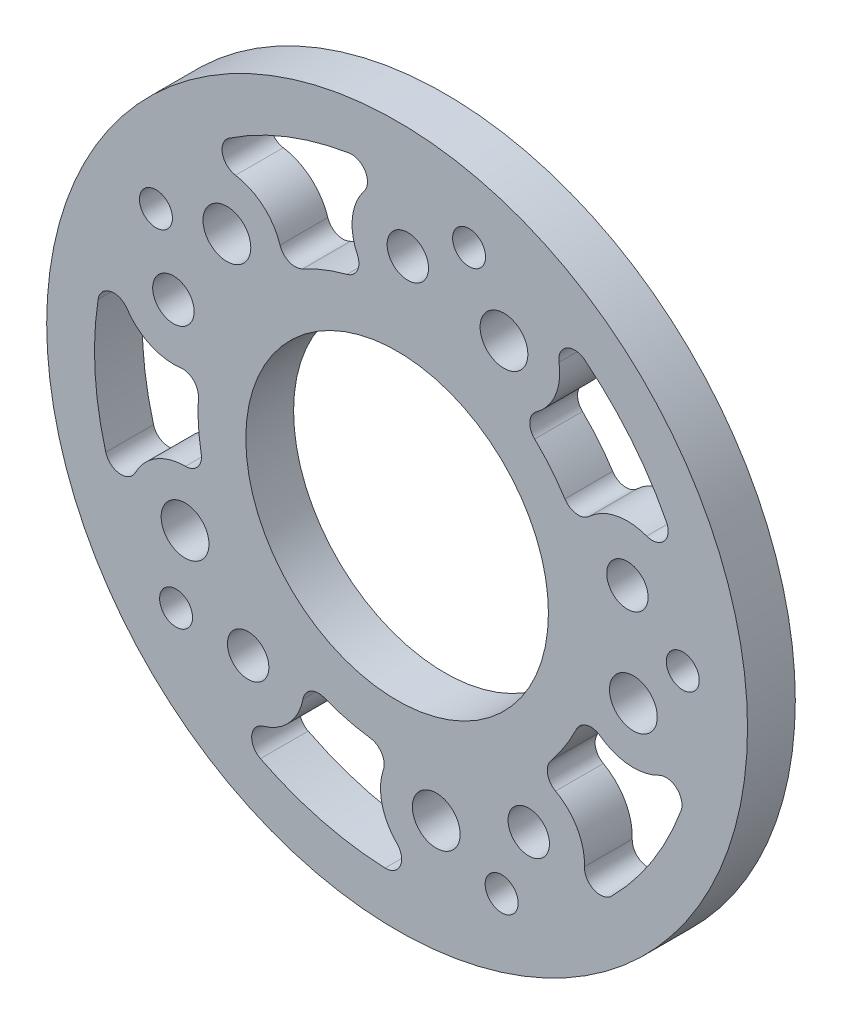
from build123d import *

# Parameters (mm, degrees)
SKETCH_1_R      = 22
SKETCH_1_R_2    = 9.5
SKETCH_1_R_3    = 1.3
SKETCH_1_R_4    = 1.5
SKETCH_1_R_5    = 1.035150144
EXTRUDE_1_DEPTH = 3


with BuildPart() as part:
    # 草图1 → 凸台-拉伸1 (new body)
    with BuildSketch(Plane.XY):
        Circle(SKETCH_1_R)
        Circle(SKETCH_1_R_2, mode=Mode.SUBTRACT)
        with Locations((8.264326198, -12.518023506)):
            Circle(SKETCH_1_R_3, mode=Mode.SUBTRACT)
        with Locations((-9.351530584, -11.728123283)):
            Circle(SKETCH_1_R_3, mode=Mode.SUBTRACT)
        with Locations((-14.043889946, 5.269644693)):
            Circle(SKETCH_1_R_3, mode=Mode.SUBTRACT)
        with Locations((0.671929263, 14.984942812)):
            Circle(SKETCH_1_R_3, mode=Mode.SUBTRACT)
        with Locations((14.459165069, 3.991559284)):
            Circle(SKETCH_1_R_3, mode=Mode.SUBTRACT)
        with Locations((6.708763262, 13.416128186)):
            Circle(SKETCH_1_R_4, mode=Mode.SUBTRACT)
        with Locations((14.832617994, -2.234601409)):
            Circle(SKETCH_1_R_4, mode=Mode.SUBTRACT)
        with Locations((2.4582988, -14.797187807)):
            Circle(SKETCH_1_R_4, mode=Mode.SUBTRACT)
        with Locations((-13.313305781, -6.910563594)):
            Circle(SKETCH_1_R_4, mode=Mode.SUBTRACT)
        with Locations((-10.686374275, 10.526224625)):
            Circle(SKETCH_1_R_4, mode=Mode.SUBTRACT)
        with Locations((-15.140028741, 9.670334022)):
            Circle(SKETCH_1_R_5, mode=Mode.SUBTRACT)
        with Locations((4.51850801, 17.387320545)):
            Circle(SKETCH_1_R_5, mode=Mode.SUBTRACT)
        with Locations((17.932620269, 1.075621048)):
            Circle(SKETCH_1_R_5, mode=Mode.SUBTRACT)
        with Locations((6.564460824, -16.722550178)):
            Circle(SKETCH_1_R_5, mode=Mode.SUBTRACT)
        with Locations((-13.875560362, -11.410725437)):
            Circle(SKETCH_1_R_5, mode=Mode.SUBTRACT)
        with BuildLine():
            ThreePointArc((-5.923480438, 11.007378412), (-6.772768209, 10.961109563), (-7.350473407, 11.585358894))
            ThreePointArc((-7.350473407, 11.585358894), (-8.407095271, 13.182328392), (-10.145967922, 13.984253106))
            ThreePointArc((-10.145967922, 13.984253106), (-10.968173498, 14.757231005), (-10.546653113, 15.804053534))
            ThreePointArc((-10.546653113, 15.804053534), (-6.942710719, 17.686117943), (-3.020854346, 18.758316529))
            ThreePointArc((-3.020854346, 18.758316529), (-1.999770978, 18.277790153), (-2.076575062, 17.151904734))
            ThreePointArc((-2.076575062, 17.151904734), (-2.805565056, 15.381217034), (-2.49364552, 13.491913579))
            ThreePointArc((-2.49364552, 13.491913579), (-2.492417598, 12.641367275), (-3.146384684, 12.097531295))
            ThreePointArc((-3.146384684, 12.097531295), (-4.567572841, 11.63560391), (-5.923480438, 11.007378412))
        make_face(mode=Mode.SUBTRACT)
        with BuildLine():
            ThreePointArc((10.533149631, 6.730732416), (9.654659288, 7.939619262), (8.638182844, 9.035031663))
            ThreePointArc((8.638182844, 9.035031663), (8.3317342, 9.82845447), (8.74690987, 10.570788416))
            ThreePointArc((8.74690987, 10.570788416), (9.939204005, 12.069186239), (10.164538529, 13.97076077))
            ThreePointArc((10.164538529, 13.97076077), (10.645608702, 14.991588048), (11.771453052, 14.91418429))
            ThreePointArc((11.771453052, 14.91418429), (14.675082118, 12.068221279), (16.90672384, 8.669641804))
            ThreePointArc((16.90672384, 8.669641804), (16.765248211, 7.550042997), (15.67073378, 7.275170293))
            ThreePointArc((15.67073378, 7.275170293), (13.761439408, 7.421308386), (12.060993483, 6.540828404))
            ThreePointArc((12.060993483, 6.540828404), (11.252455327, 6.276827318), (10.533149631, 6.730732416))
        make_face(mode=Mode.SUBTRACT)
        with BuildLine():
            ThreePointArc((9.656229164, -7.937709892), (10.534480431, -6.728649348), (11.262171037, -5.423421755))
            ThreePointArc((11.262171037, -5.423421755), (11.92206313, -4.886790644), (12.756361003, -5.052252365))
            ThreePointArc((12.756361003, -5.052252365), (14.549861167, -5.72316108), (16.427998213, -5.349848101))
            ThreePointArc((16.427998213, -5.349848101), (17.547521507, -5.491920046), (17.821811196, -6.586580728))
            ThreePointArc((17.821811196, -6.586580728), (16.012410255, -10.227547009), (13.469784317, -13.400183224))
            ThreePointArc((13.469784317, -13.400183224), (12.361264202, -13.611606964), (11.761621167, -12.655602219))
            ThreePointArc((11.761621167, -12.655602219), (11.310602344, -10.794596211), (9.947749431, -9.449459311))
            ThreePointArc((9.947749431, -9.449459311), (9.446817447, -8.762074651), (9.656229164, -7.937709892))
        make_face(mode=Mode.SUBTRACT)
        with BuildLine():
            ThreePointArc((-4.565271804, -11.636506922), (-3.143992328, -12.098153257), (-1.677778356, -12.386890642))
            ThreePointArc((-1.677778356, -12.386890642), (-0.96349397, -12.848657184), (-0.863045197, -13.693252097))
            ThreePointArc((-0.863045197, -13.693252097), (-0.946895272, -15.60629431), (-0.011477266, -17.277148731))
            ThreePointArc((-0.011477266, -17.277148731), (0.199356008, -18.3857813), (-0.756967992, -18.98491505))
            ThreePointArc((-0.756967992, -18.98491505), (-4.778868338, -18.389192951), (-8.58193931, -16.951410492))
            ThreePointArc((-8.58193931, -16.951410492), (-9.12556679, -15.962478742), (-8.401652136, -15.096762613))
            ThreePointArc((-8.401652136, -15.096762613), (-6.771102726, -14.092735739), (-5.912946223, -12.380915433))
            ThreePointArc((-5.912946223, -12.380915433), (-5.414001059, -11.692087264), (-4.565271804, -11.636506922))
        make_face(mode=Mode.SUBTRACT)
        with BuildLine():
            ThreePointArc((-12.477722307, 0.745953104), (-12.47757455, -0.748420566), (-12.299095087, -2.232097677))
            ThreePointArc((-12.299095087, -2.232097677), (-12.517535151, -3.054116206), (-13.289752269, -3.410642848))
            ThreePointArc((-13.289752269, -3.410642848), (-15.135074629, -3.922059242), (-16.435091554, -5.328017043))
            ThreePointArc((-16.435091554, -5.328017043), (-17.424312718, -5.871117707), (-18.289643143, -5.146742046))
            ThreePointArc((-18.289643143, -5.146742046), (-18.965913316, -1.137599261), (-18.773714501, 2.923635383))
            ThreePointArc((-18.773714501, 2.923635383), (-18.001174645, 3.746252557), (-16.954127749, 3.325289805))
            ThreePointArc((-16.954127749, 3.325289805), (-15.49537397, 2.084806529), (-13.60215117, 1.797632761))
            ThreePointArc((-13.60215117, 1.797632761), (-12.792854116, 1.535967322), (-12.477722307, 0.745953104))
        make_face(mode=Mode.SUBTRACT)
    extrude(amount=EXTRUDE_1_DEPTH)


solid = part.part
